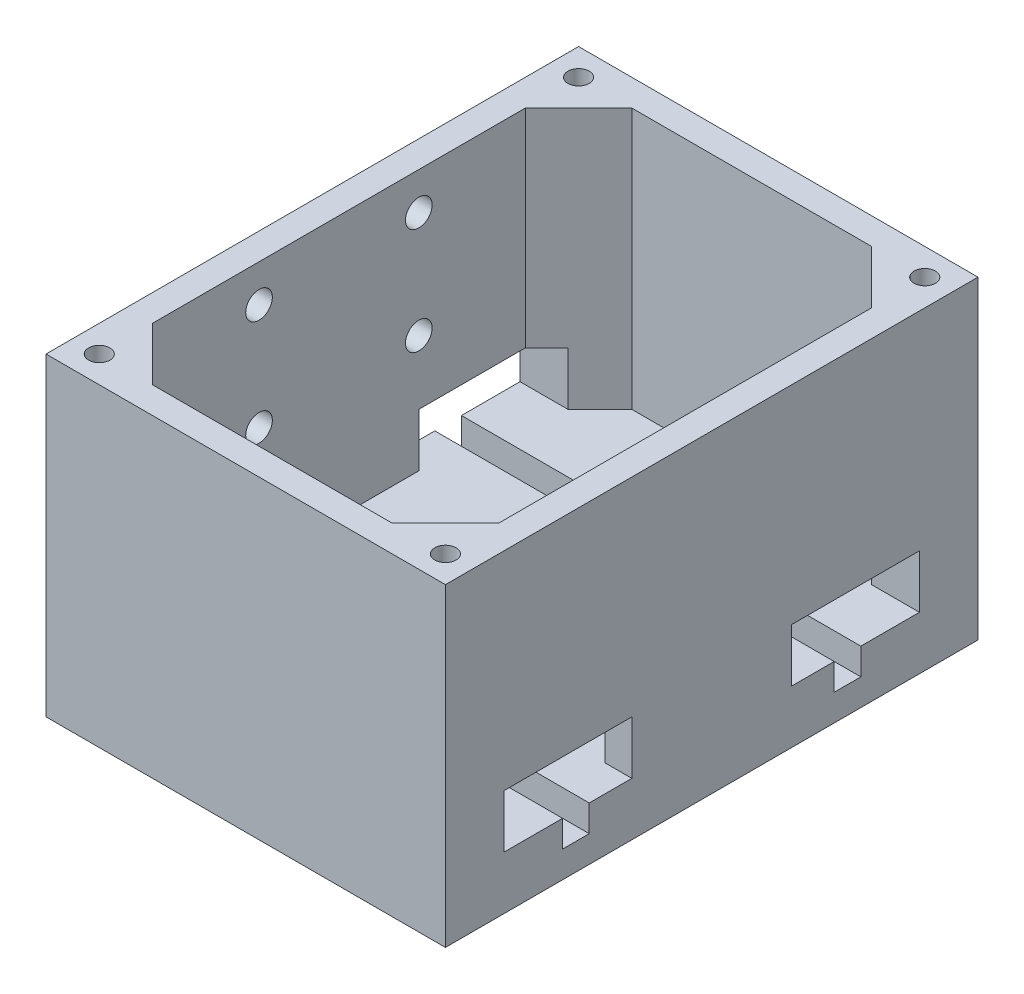
from build123d import *

# Parameters (mm, degrees)
SKETCH1_W           = 75
SKETCH1_H           = 100
BOSS_EXTRUDE1_DEPTH = 10
SKETCH2_R           = 5
BOSS_EXTRUDE2_DEPTH = 5
SKETCH3_W           = 75
SKETCH3_H           = 5
CUT_EXTRUDE1_DEPTH  = 5
SKETCH4_W           = 75
SKETCH4_H           = 100
SKETCH4_W_2         = 65
SKETCH4_H_2         = 90
BOSS_EXTRUDE3_DEPTH = 49
CUT_EXTRUDE2_REACH  = 109.731
SKETCH5_W           = 24
SKETCH5_H           = 10
CHAMFER1_SIZE       = 10
SKETCH6_R           = 2
CUT_EXTRUDE3_DEPTH  = 10
SKETCH8_R           = 2.5
CUT_EXTRUDE4_DEPTH  = 20
SKETCH9_W           = 5
SKETCH9_H           = 5
BOSS_EXTRUDE5_DEPTH = 10


with BuildPart() as part:
    # Sketch1 → Boss-Extrude1 (new body)
    with BuildSketch(Plane(origin=(0, 0, 0), x_dir=(1, 0, 0), z_dir=(0, 1, 0))):
        Rectangle(SKETCH1_W, SKETCH1_H)
    extrude(amount=BOSS_EXTRUDE1_DEPTH)

    # Sketch2 → Boss-Extrude2 (add)
    with BuildSketch(Plane(origin=(0, 10, 0), x_dir=(1, 0, 0), z_dir=(0, 1, 0))):
        with Locations(Location((0, 0, 0), (0, 0, 270))):
            Circle(SKETCH2_R)
    extrude(amount=BOSS_EXTRUDE2_DEPTH)

    # Sketch3 → Cut-Extrude1 (cut)
    with BuildSketch(Plane(origin=(0, 10, 0), x_dir=(1, 0, 0), z_dir=(0, 1, 0))):
        with Locations((0, -25.5)):
            Rectangle(SKETCH3_W, SKETCH3_H)
        with Locations((0, 25.5)):
            Rectangle(SKETCH3_W, SKETCH3_H)
    extrude(amount=-CUT_EXTRUDE1_DEPTH, mode=Mode.SUBTRACT)

    # Sketch4 → Boss-Extrude3 (add)
    with BuildSketch(Plane(origin=(0, 10, 0), x_dir=(1, 0, 0), z_dir=(0, 1, 0))):
        Rectangle(SKETCH4_W, SKETCH4_H)
        Rectangle(SKETCH4_W_2, SKETCH4_H_2, mode=Mode.SUBTRACT)
    extrude(amount=BOSS_EXTRUDE3_DEPTH)

    # Cut-Extrude2: up to this face of the body (flat: up to its plane)
    cut_extrude2_end = Plane(part.part.faces().sort_by_distance((37.5, 29.688034188, 0))[0])
    # Sketch5 → Cut-Extrude2 (cut, up to the picked face)
    with BuildSketch(Plane.ZY.offset(37.5), mode=Mode.PRIVATE) as cut_extrude2_sk1:
        with Locations((27, 15)):
            Rectangle(SKETCH5_W, SKETCH5_H)
    cut_extrude2_tool1 = split(extrude(cut_extrude2_sk1.sketch, amount=-CUT_EXTRUDE2_REACH, mode=Mode.PRIVATE), bisect_by=cut_extrude2_end, keep=Keep.BOTH, mode=Mode.PRIVATE)
    # Sketch5 → Cut-Extrude2 (cut, up to the picked face)
    with BuildSketch(Plane.ZY.offset(37.5), mode=Mode.PRIVATE) as cut_extrude2_sk2:
        with Locations((-27, 15)):
            Rectangle(SKETCH5_W, SKETCH5_H)
    cut_extrude2_tool2 = split(extrude(cut_extrude2_sk2.sketch, amount=-CUT_EXTRUDE2_REACH, mode=Mode.PRIVATE), bisect_by=cut_extrude2_end, keep=Keep.BOTH, mode=Mode.PRIVATE)
    add(cut_extrude2_tool1.solids().sort_by(Axis((-37.5, 15, 27), (1, 0, 0)))[0], mode=Mode.SUBTRACT)
    add(cut_extrude2_tool2.solids().sort_by(Axis((-37.5, 15, -27), (1, 0, 0)))[0], mode=Mode.SUBTRACT)

    # Chamfer1
    chamfer1_edges = [part.edges().sort_by_distance(p)[0] for p in [
        (32.5, 34.5, 45),
        (-32.5, 34.5, 45),
        (-32.5, 34.5, -45),
        (32.5, 34.5, -45),
    ]]
    chamfer(chamfer1_edges, length=CHAMFER1_SIZE)

    # Sketch6 → Cut-Extrude3 (cut)
    with BuildSketch(Plane(origin=(0, 59, 0), x_dir=(1, 0, 0), z_dir=(0, 1, 0))):
        with Locations(Location((-32.5, 45, 0), (0, 0, 270))):
            Circle(SKETCH6_R)
        with Locations(Location((32.5, 45, 0), (0, 0, 90))):
            Circle(SKETCH6_R)
        with Locations(Location((32.5, -45, 0), (0, 0, 270))):
            Circle(SKETCH6_R)
        with Locations(Location((-32.5, -45, 0), (0, 0, 90))):
            Circle(SKETCH6_R)
    extrude(amount=-CUT_EXTRUDE3_DEPTH, mode=Mode.SUBTRACT)

    # Sketch8 → Cut-Extrude4 (cut)
    with BuildSketch(Plane.ZY.offset(37.5)):
        with Locations((-15, 52)):
            Circle(SKETCH8_R)
        with Locations((15, 52)):
            Circle(SKETCH8_R)
        with Locations((-15, 32)):
            Circle(SKETCH8_R)
        with Locations((15, 32)):
            Circle(SKETCH8_R)
    extrude(amount=-CUT_EXTRUDE4_DEPTH, mode=Mode.SUBTRACT)

    # Sketch9 → Boss-Extrude5 (add)
    with BuildSketch(Plane(origin=(0, 10, 0), x_dir=(1, 0, 0), z_dir=(0, 1, 0))):
        with Locations((5.5, 33.5)):
            Rectangle(SKETCH9_W, SKETCH9_H)
        with Locations((-5.5, -33.5)):
            Rectangle(SKETCH9_W, SKETCH9_H)
    extrude(amount=BOSS_EXTRUDE5_DEPTH)


solid = part.part
